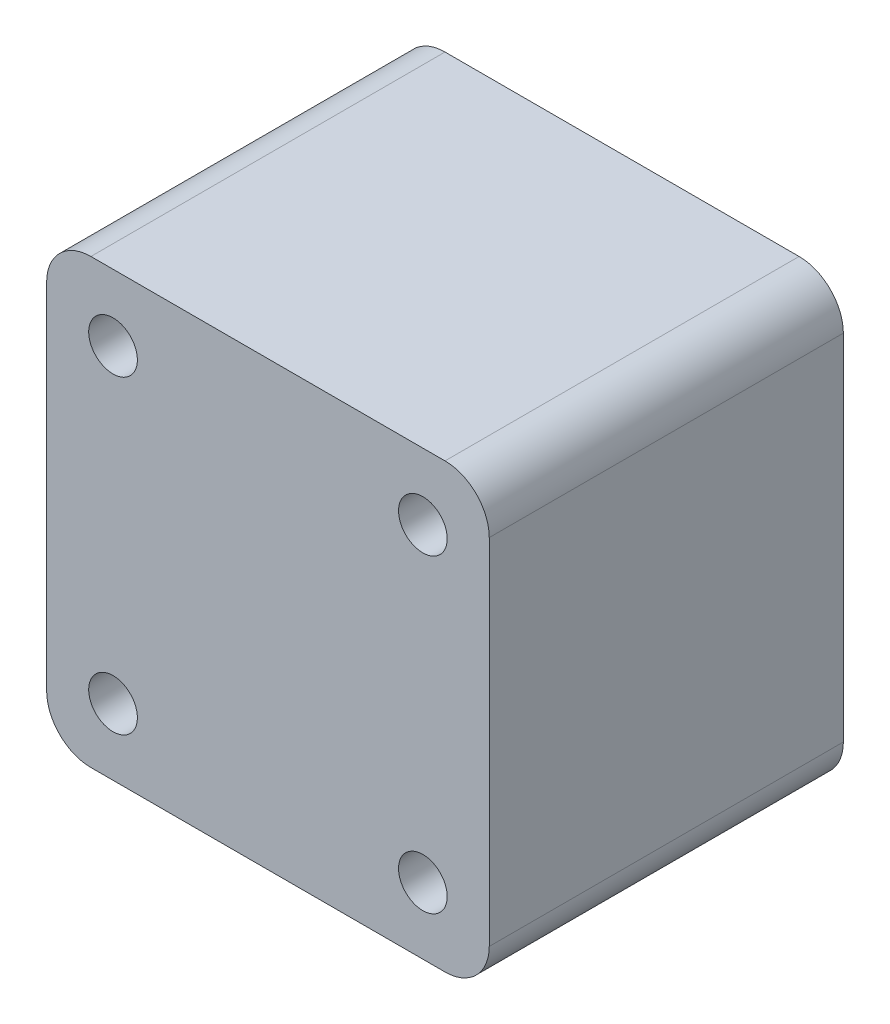
from build123d import *

# Parameters (mm, degrees)
SKETCH_1_W          = 100
SKETCH_1_H          = 100
EXTRUDE_1_DEPTH     = 80
SKETCH_2_R          = 5.5
CUT_EXTRUDE_2_DEPTH = 107.77078252
FILLET_1_R          = 10
FILLET_2_R          = 10


with BuildPart() as part:
    # 草图1 → 凸台-拉伸1 (new body)
    with BuildSketch(Plane.XY):
        Rectangle(SKETCH_1_W, SKETCH_1_H)
    extrude(amount=EXTRUDE_1_DEPTH)

    # 草图2 → 切除-拉伸2 (cut, through all)
    with BuildSketch(Plane.XY.offset(80)):
        with Locations((-35, 35)):
            Circle(SKETCH_2_R)
        with Locations((35, 35)):
            Circle(SKETCH_2_R)
        with Locations((-35, -35)):
            Circle(SKETCH_2_R)
        with Locations((35, -35)):
            Circle(SKETCH_2_R)
    extrude(amount=-CUT_EXTRUDE_2_DEPTH, mode=Mode.SUBTRACT)

    # 圆角1
    fillet_1_edges = [part.edges().sort_by_distance(p)[0] for p in [
        (-50, 50, 40),
    ]]
    fillet(fillet_1_edges, radius=FILLET_1_R)

    # 圆角2
    fillet_2_edges = [part.edges().sort_by_distance(p)[0] for p in [
        (50, -50, 40),
        (-50, -50, 40),
        (50, 50, 40),
    ]]
    fillet(fillet_2_edges, radius=FILLET_2_R)


solid = part.part
